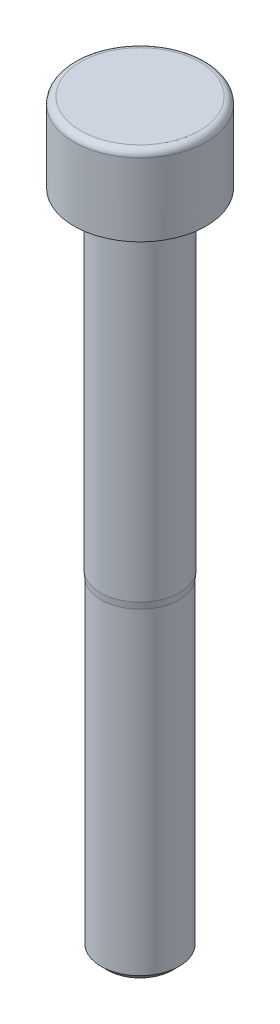
from build123d import *

# Parameters (mm, degrees)
CHANFREIN1_SIZE = 0.5
CONG_1_R        = 0.5


with BuildPart() as part:
    # Esquisse1 → Révolution1 (revolve)
    with BuildSketch(Plane.XY, mode=Mode.PRIVATE) as r_volution1_sk:
        Polygon((0, 56), (5, 56), (5, 50), (3, 50), (3, 25), (2.95, 24.5), (2.95, 0), (0, 0), align=None)
    revolve(r_volution1_sk.sketch.rotate(Axis((0, 0, 0), (0, 1, 0)), 90), axis=Axis((0, 0, 0), (0, 1, 0)))

    # Chanfrein1
    chanfrein1_edges = [part.edges().sort_by_distance(p)[0] for p in [
        (0, 0, 2.95),
    ]]
    chamfer(chanfrein1_edges, length=CHANFREIN1_SIZE)

    # Congé1
    cong_1_edges = [part.edges().sort_by_distance(p)[0] for p in [
        (0, 56, 5),
    ]]
    fillet(cong_1_edges, radius=CONG_1_R)


solid = part.part
